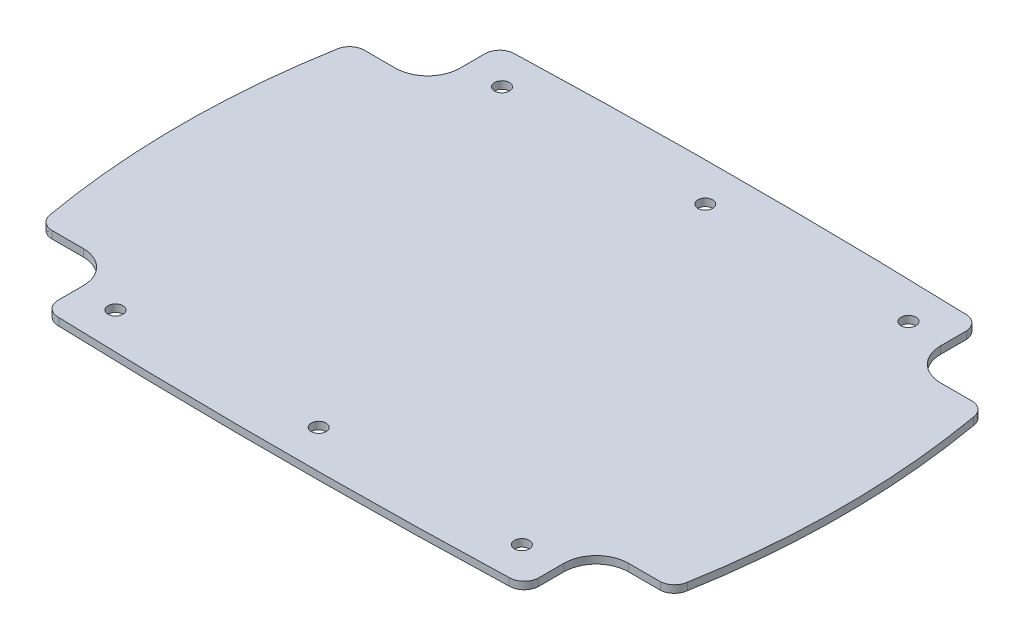
from build123d import *

# Parameters (mm, degrees)
SKETCH_1_R      = 1.5
EXTRUDE_1_DEPTH = 1.5


with BuildPart() as part:
    # Эскиз1 → Бобышка-Вытянуть1 (new body)
    with BuildSketch(Plane(origin=(0, 0, 0), x_dir=(1, 0, 0), z_dir=(0, 1, 0))):
        with BuildLine():
            Line((-55.237590769, 32.053388295), (-61.7059188, 32.053388295))
            add(Edge.make_bspline(
                [(-61.7059188, 32.053388295), (-62.052521275, 32.031778061), (-62.744091711, 31.865477519), (-63.629073773, 31.277665282), (-64.260833863, 30.4238638), (-64.461976453, 29.741355241), (-64.501017169, 29.396222514)],
                knots=[0, 0, 0, 0, 0.25, 0.5, 0.75, 1, 1, 1, 1], degree=3))
            ThreePointArc((-64.501017169, 29.396222514), (-67.014010182, 0.462468283), (-64.469471559, -28.468528779))
            add(Edge.make_bspline(
                [(-64.469471559, -28.468528779), (-64.409048461, -28.810456535), (-64.166033983, -29.478831911), (-63.482303299, -30.291913357), (-62.562853807, -30.823470466), (-61.861851099, -30.946611705), (-61.514440275, -30.946611705)],
                knots=[0, 0, 0, 0, 0.25, 0.5, 0.75, 1, 1, 1, 1], degree=3))
            Line((-61.514440275, -30.946611705), (-55.237590769, -30.946611705))
            ThreePointArc((-55.237590769, -30.946611705), (-50.641396691, -32.850417627), (-48.737590769, -37.446611705))
            Line((-48.737590769, -37.446611705), (-48.737590769, -42.6958694))
            add(Edge.make_bspline(
                [(-48.737590769, -42.6958694), (-48.71091302, -43.077168109), (-48.507739461, -43.837500854), (-47.799680152, -44.773477074), (-46.795875092, -45.377409673), (-46.015918692, -45.499416665), (-45.633251479, -45.485174585)],
                knots=[0, 0, 0, 0, 0.25, 0.5, 0.75, 1, 1, 1, 1], degree=3))
            ThreePointArc((-45.633251479, -45.485174585), (-0.237590768, -46.223055901), (45.158069943, -45.485174585))
            add(Edge.make_bspline(
                [(45.158069943, -45.485174585), (45.539941303, -45.499387045), (46.317416103, -45.378581331), (47.323432889, -44.774398344), (48.030926989, -43.840884512), (48.235672001, -43.078018207), (48.26240923, -42.69586945)],
                knots=[0, 0, 0, 0, 0.25, 0.5, 0.75, 1, 1, 1, 1], degree=3))
            Line((48.26240923, -42.69586945), (48.26240923, -37.446611743))
            ThreePointArc((48.26240923, -37.446611743), (50.166215153, -32.850417666), (54.76240923, -30.946611743))
            Line((54.76240923, -30.946611743), (61.230737262, -30.946611743))
            add(Edge.make_bspline(
                [(61.230737262, -30.946611743), (61.577339736, -30.925001509), (62.268910172, -30.758700967), (63.153892234, -30.17088873), (63.785652325, -29.317087248), (63.986794915, -28.634578689), (64.025835631, -28.289445963)],
                knots=[0, 0, 0, 0, 0.25, 0.5, 0.75, 1, 1, 1, 1], degree=3))
            ThreePointArc((64.025835631, -28.289445963), (66.538853426, 0.553388257), (64.025835631, 29.396222476))
            add(Edge.make_bspline(
                [(64.025835631, 29.396222476), (63.98680709, 29.741247568), (63.785855195, 30.423449895), (63.154045977, 31.277502704), (62.269456107, 31.865245071), (61.577474792, 32.031769602), (61.230737261, 32.053388257)],
                knots=[0, 0, 0, 0, 0.25, 0.5, 0.75, 1, 1, 1, 1], degree=3))
            Line((61.230737261, 32.053388257), (54.762409231, 32.053388257))
            ThreePointArc((54.762409231, 32.053388257), (50.166215153, 33.957194179), (48.262409231, 38.553388257))
            Line((48.262409231, 38.553388257), (48.262409231, 43.802645952))
            add(Edge.make_bspline(
                [(48.262409231, 43.802645952), (48.235731482, 44.18394466), (48.032557923, 44.944277406), (47.324498614, 45.880253626), (46.320693554, 46.484186224), (45.540737153, 46.606193217), (45.158069941, 46.591951137)],
                knots=[0, 0, 0, 0, 0.25, 0.5, 0.75, 1, 1, 1, 1], degree=3))
            ThreePointArc((45.158069941, 46.591951137), (-0.237590771, 47.329832452), (-45.633251482, 46.591951137))
            add(Edge.make_bspline(
                [(-45.633251482, 46.591951137), (-46.015122842, 46.606163597), (-46.792597641, 46.485357883), (-47.798614427, 45.881174896), (-48.506108527, 44.947661064), (-48.71085354, 44.184794759), (-48.737590769, 43.802646001)],
                knots=[0, 0, 0, 0, 0.25, 0.5, 0.75, 1, 1, 1, 1], degree=3))
            Line((-48.737590769, 43.802646001), (-48.737590769, 38.553388295))
            ThreePointArc((-48.737590769, 38.553388295), (-50.641396691, 33.957194217), (-55.237590769, 32.053388295))
        make_face()
        with Locations(Location((-41.237590769, 39.553388295, 0), (0, 0, 270))):
            Circle(SKETCH_1_R, mode=Mode.SUBTRACT)
        with Locations(Location((-0.237590769, 39.553388295, 0), (0, 0, 270))):
            Circle(SKETCH_1_R, mode=Mode.SUBTRACT)
        with Locations(Location((40.762409231, 39.553388295, 0), (0, 0, 270))):
            Circle(SKETCH_1_R, mode=Mode.SUBTRACT)
        with Locations(Location((-41.237590769, -38.446611705, 0), (0, 0, 270))):
            Circle(SKETCH_1_R, mode=Mode.SUBTRACT)
        with Locations(Location((-0.237590769, -38.446611705, 0), (0, 0, 270))):
            Circle(SKETCH_1_R, mode=Mode.SUBTRACT)
        with Locations(Location((40.762409231, -38.446611705, 0), (0, 0, 270))):
            Circle(SKETCH_1_R, mode=Mode.SUBTRACT)
    extrude(amount=EXTRUDE_1_DEPTH)


solid = part.part
